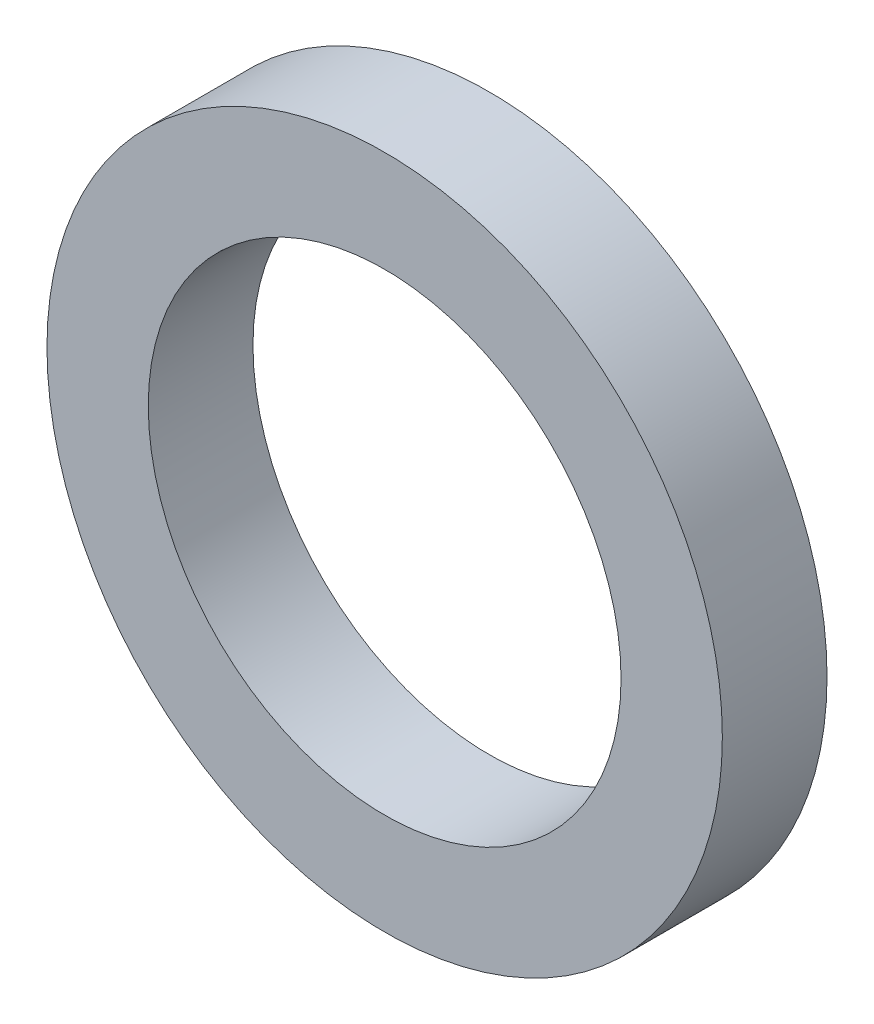
from build123d import *

# Parameters (mm, degrees)
SKETCH1_R           = 20
SKETCH1_R_2         = 14
BOSS_EXTRUDE1_DEPTH = 3.1


with BuildPart() as part:
    # Sketch1 → Boss-Extrude1 (new, symmetric)
    with BuildSketch(Plane.XY):
        with Locations(Location((0, 0, 0), (0, 0, 180))):
            Circle(SKETCH1_R)
        with Locations(Location((0, 0, 0), (0, 0, 180))):
            Circle(SKETCH1_R_2, mode=Mode.SUBTRACT)
    extrude(amount=BOSS_EXTRUDE1_DEPTH, both=True)


solid = part.part
